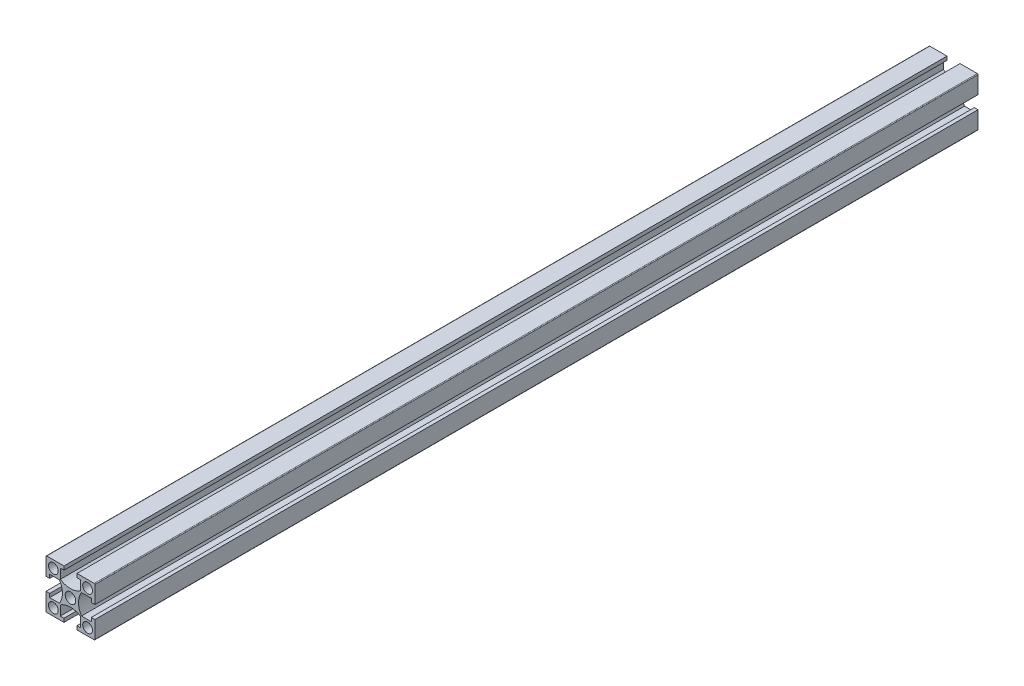
from build123d import *

# Parameters (mm, degrees)
SKETCH_1_W               = 20
SKETCH_1_H               = 20
SKETCH_1_R               = 2
SKETCH_1_R_2             = 2.15
EXTRUDE_1_DEPTH          = 361
CUT_EXTRUDE_1_REACH      = 363.277
PATTERN_CIRCULAR_1_COUNT = 4
FILLET_1_R               = 0.3
SKETCH_3_R               = 2.5
CUT_EXTRUDE_2_DEPTH      = 362.691857802
SKETCH_4_R               = 2.15
CUT_EXTRUDE_3_DEPTH      = 362.691857901


with BuildPart() as part:
    # 스케치1 → 보스-돌출1 (new body)
    with BuildSketch(Plane.XY):
        Rectangle(SKETCH_1_W, SKETCH_1_H)
        with Locations((-7, -7)):
            Circle(SKETCH_1_R, mode=Mode.SUBTRACT)
        with Locations((7, -7)):
            Circle(SKETCH_1_R, mode=Mode.SUBTRACT)
        with Locations((-7, 7)):
            Circle(SKETCH_1_R, mode=Mode.SUBTRACT)
        Circle(SKETCH_1_R_2, mode=Mode.SUBTRACT)
        with Locations((7, 7)):
            Circle(SKETCH_1_R, mode=Mode.SUBTRACT)
    extrude(amount=EXTRUDE_1_DEPTH)

    # 스케치1<3> → 컷-돌출1 (cut, up to next)
    with BuildSketch(Plane.XY, mode=Mode.PRIVATE) as cut_extrude_1_sk1:
        with BuildLine():
            Line((-8.5, 2.65), (-10, 2.65))
            Line((-10, 2.65), (-10, -2.65))
            Line((-10, -2.65), (-8.5, -2.65))
            Line((-8.5, -2.65), (-8.5, -4.15))
            Line((-8.5, -4.15), (-4.503166667, -4.15))
            ThreePointArc((-4.503166667, -4.15), (-3.3, 0), (-4.503166667, 4.15))
            Line((-4.503166667, 4.15), (-8.5, 4.15))
            Line((-8.5, 4.15), (-8.5, 2.65))
        make_face()
    cut_extrude_1_tool1 = extrude(cut_extrude_1_sk1.sketch, amount=CUT_EXTRUDE_1_REACH, mode=Mode.PRIVATE) & part.part
    cut_extrude_1 = cut_extrude_1_tool1.solids().sort_by_distance((-6.606913, 0, 0))[0]
    add(cut_extrude_1, mode=Mode.SUBTRACT)

    # 원형 패턴1: 컷-돌출1 ×4 about axis
    pattern_circular_1_axis = Axis((0, 0, 361), (0, 0, -1))
    for i in range(1, PATTERN_CIRCULAR_1_COUNT):
        add(cut_extrude_1.rotate(pattern_circular_1_axis, i * 360 / PATTERN_CIRCULAR_1_COUNT), mode=Mode.SUBTRACT)

    # 필렛1
    fillet_1_edges = [part.edges().sort_by_distance(p)[0] for p in [
        (10, -10, 180.5),
        (-10, -10, 180.5),
        (-10, 10, 180.5),
        (10, 10, 180.5),
    ]]
    fillet(fillet_1_edges, radius=FILLET_1_R)

    # 스케치3 → 컷-돌출2 (cut, through all)
    with BuildSketch(Plane(origin=(0, 10, 0), x_dir=(1, 0, 0), z_dir=(0, 1, 0))):
        with Locations((0, -11)):
            Circle(SKETCH_3_R)
        with Locations((0, -250)):
            Circle(SKETCH_3_R)
    extrude(amount=-CUT_EXTRUDE_2_DEPTH, mode=Mode.SUBTRACT)

    # 스케치4 → 컷-돌출3 (cut, through all)
    with BuildSketch(Plane(origin=(0, 10, 0), x_dir=(1, 0, 0), z_dir=(0, 1, 0))):
        with Locations((0, -56)):
            Circle(SKETCH_4_R)
        with Locations((0, -108)):
            Circle(SKETCH_4_R)
        with Locations((0, -351)):
            Circle(SKETCH_4_R)
        with Locations((0, -271)):
            Circle(SKETCH_4_R)
    extrude(amount=-CUT_EXTRUDE_3_DEPTH, mode=Mode.SUBTRACT)


solid = part.part
